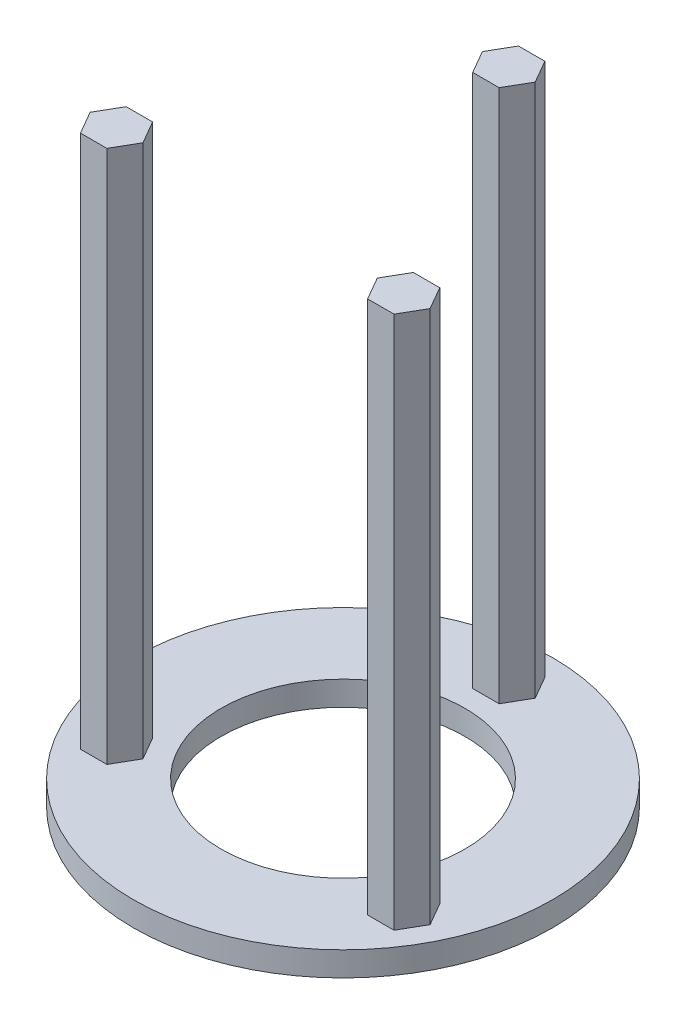
from build123d import *

# Parameters (mm, degrees)
SKETCH_1_R      = 27.5
SKETCH_1_R_2    = 16
EXTRUDE_1_DEPTH = 3.2
EXTRUDE_2_DEPTH = 70


with BuildPart() as part:
    # Эскиз1 → Бобышка-Вытянуть1 (new body)
    with BuildSketch(Plane(origin=(0, 0, 0), x_dir=(1, 0, 0), z_dir=(0, 1, 0))):
        with Locations(Location((0, 0, 0), (0, 0, 270))):
            Circle(SKETCH_1_R)
        with Locations(Location((0, 0, 0), (0, 0, 270))):
            Circle(SKETCH_1_R_2, mode=Mode.SUBTRACT)
    extrude(amount=EXTRUDE_1_DEPTH)

    # Эскиз2 → Бобышка-Вытянуть2 (add)
    with BuildSketch(Plane(origin=(0, 3.2, 0), x_dir=(1, 0, 0), z_dir=(0, 1, 0))):
        Polygon((17.104001725, -13.875), (20.56810334, -13.875), (22.300154147, -10.875), (20.56810334, -7.875), (17.104001725, -7.875), (15.371950917, -10.875), align=None)
        Polygon((3.464101615, 21.75), (1.732050808, 24.75), (-1.732050808, 24.75), (-3.464101615, 21.75), (-1.732050808, 18.75), (1.732050808, 18.75), align=None)
        Polygon((-20.56810334, -7.875), (-22.300154147, -10.875), (-20.56810334, -13.875), (-17.104001725, -13.875), (-15.371950917, -10.875), (-17.104001725, -7.875), align=None)
    extrude(amount=EXTRUDE_2_DEPTH)


solid = part.part
